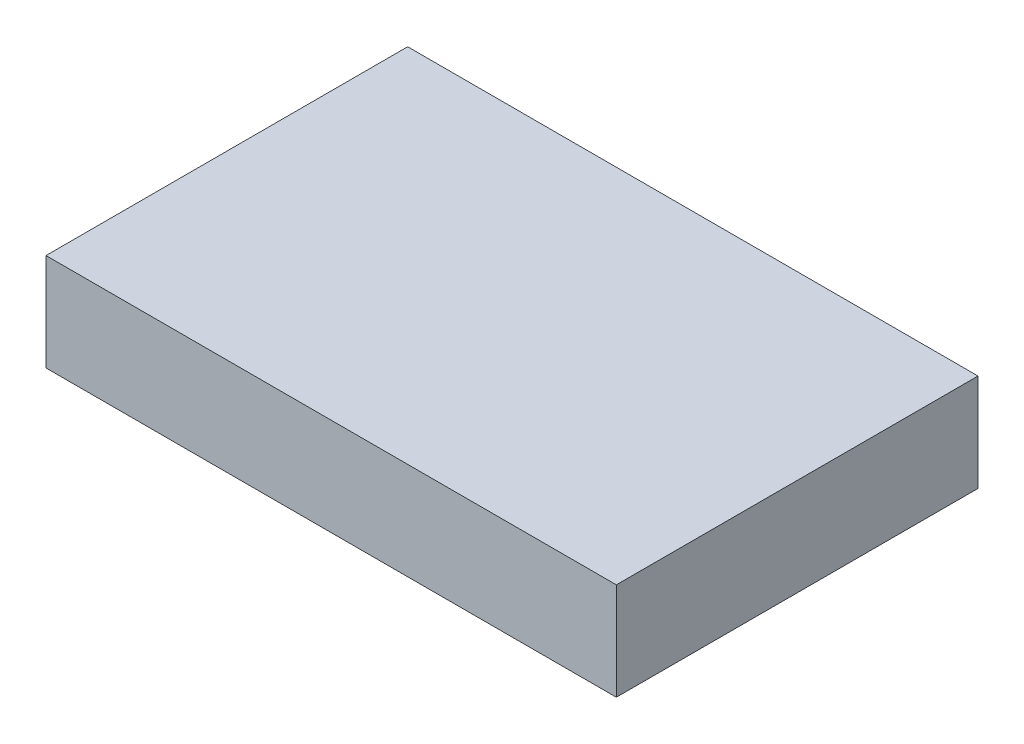
from build123d import *

# Parameters (mm, degrees)
BOSS_EXTRU_1_DEPTH      = 14
BOSS_EXTRU_1_DEPTH_BACK = 14
ESQUISSE1_W             = 164
ESQUISSE1_H             = 104


with BuildPart() as part:
    # Esquisse1 → Boss.-Extru.1 (new, two sides: drawn at the far end of the back side and taken through both)
    with BuildSketch(Plane(origin=(0, 0, 0), x_dir=(1, 0, 0), z_dir=(0, 1, 0)).offset(-BOSS_EXTRU_1_DEPTH_BACK)):
        Rectangle(ESQUISSE1_W, ESQUISSE1_H)
    extrude(amount=BOSS_EXTRU_1_DEPTH + BOSS_EXTRU_1_DEPTH_BACK)


solid = part.part
